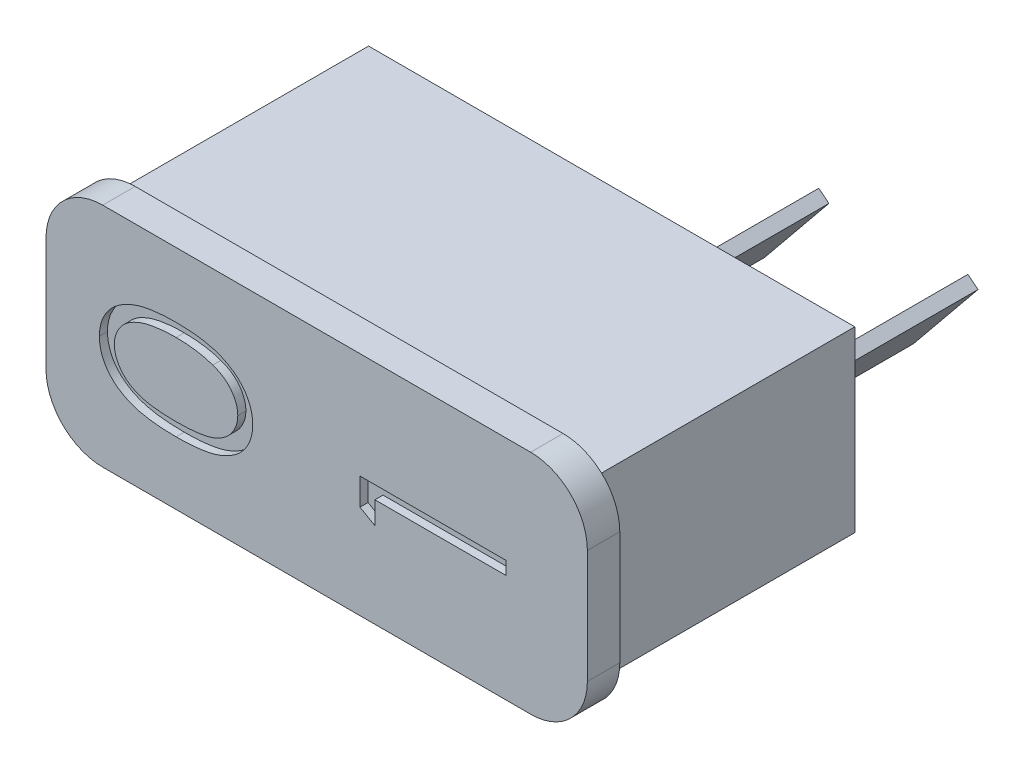
from build123d import *

# Parameters (mm, degrees)
ESQUISSE1_W             = 30
ESQUISSE1_H             = 11
BOSS_EXTRU_1_DEPTH      = 16.2
BOSS_EXTRU_2_DEPTH      = 9.1
ESQUISSE3_W             = 33.4
ESQUISSE3_H             = 14
BOSS_EXTRU_3_DEPTH      = 2
CONG_1_R                = 3.5
ENL_V_MAT_EXTRU_1_DEPTH = 0.5


with BuildPart() as part:
    # Esquisse1 → Boss.-Extru.1 (new body)
    with BuildSketch(Plane.XY):
        Rectangle(ESQUISSE1_W, ESQUISSE1_H)
    extrude(amount=BOSS_EXTRU_1_DEPTH)

    # Esquisse2 → Boss.-Extru.2 (add)
    with BuildSketch(Plane(origin=(0, 0, 0), x_dir=(-1, 0, 0), z_dir=(0, 0, -1))):
        Polygon((-9.520156546, -2.694554874), (-13.5, 2.189177928), (-12.879843454, 2.694554874), (-8.9, -2.189177928), align=None)
        Polygon((-0.320156546, -2.694554874), (-4.3, 2.189177928), (-3.679843454, 2.694554874), (0.3, -2.189177928), align=None)
    extrude(amount=BOSS_EXTRU_2_DEPTH)

    # Esquisse3 → Boss.-Extru.3 (add)
    with BuildSketch(Plane.XY.offset(16.2)):
        Rectangle(ESQUISSE3_W, ESQUISSE3_H)
    extrude(amount=BOSS_EXTRU_3_DEPTH)

    # Congé1
    cong_1_edges = [part.edges().sort_by_distance(p)[0] for p in [
        (16.7, -7, 17.2),
        (16.7, 7, 17.2),
        (-16.7, 7, 17.2),
        (-16.7, -7, 17.2),
    ]]
    fillet(cong_1_edges, radius=CONG_1_R)

    # Esquisse5 → Enlèv. mat.-Extru.1 (cut)
    # profile 1 of 2: a face of its own
    with BuildSketch(Plane.XY.offset(18.2)):
        with BuildLine():
            add(Edge.make_bspline(
                [(-8.672344116, -3.115384615), (-8.816594542, -3.11454114), (-9.096803073, -3.112902677), (-9.505106438, -3.094675309), (-9.888147182, -3.064395858), (-10.245943635, -3.022899755), (-10.578588179, -2.972402097), (-10.885191819, -2.904990826), (-11.167173735, -2.828329399), (-11.425453052, -2.739480033), (-11.663510816, -2.639226475), (-11.885744181, -2.530107135), (-12.0918336, -2.40780713), (-12.285008724, -2.279261226), (-12.462319222, -2.139465144), (-12.62580805, -1.99141638), (-12.774096473, -1.832153938), (-12.907286041, -1.663222517), (-13.024073857, -1.485767046), (-13.127578093, -1.304636715), (-13.212833981, -1.116595132), (-13.282575645, -0.924117757), (-13.339507374, -0.72679892), (-13.378613639, -0.524688996), (-13.403175484, -0.317319479), (-13.405526699, -0.177353753), (-13.406719116, -0.106370192)],
                knots=[0, 0, 0, 0, 1.646148282, 3.197666765, 4.66315463, 6.030252048, 7.307778049, 8.501004361, 9.610818041, 10.641065266, 11.615491391, 12.557119604, 13.464013759, 14.348536654, 15.203310953, 16.038349431, 16.863300206, 17.683791446, 18.490318933, 19.285717724, 20.06220424, 20.843281102, 21.620494212, 22.403315558, 23.190242141, 24, 24, 24, 24], degree=3))
            add(Edge.make_bspline(
                [(-13.406719116, -0.106370192), (-13.405725902, -0.034758535), (-13.403749756, 0.107723458), (-13.375934308, 0.317616697), (-13.340032104, 0.523853953), (-13.28245088, 0.7233062), (-13.213547479, 0.919744698), (-13.122630536, 1.108284414), (-13.0237513, 1.295581798), (-12.90312695, 1.47312818), (-12.769817193, 1.646228322), (-12.618476538, 1.808491632), (-12.453293353, 1.964065993), (-12.270583572, 2.107075425), (-12.073148677, 2.243649111), (-11.859333594, 2.368602577), (-11.629612167, 2.484534626), (-11.385049352, 2.593624475), (-11.119112495, 2.689020666), (-10.833460316, 2.773835506), (-10.525506096, 2.843355619), (-10.196965336, 2.90084753), (-9.846210449, 2.945472196), (-9.473952104, 2.977949275), (-9.079957413, 2.995110587), (-8.810580002, 2.99834183), (-8.672344116, 3)],
                knots=[0, 0, 0, 0, 0.810910589, 1.61342667, 2.396193133, 3.181089899, 3.963115317, 4.752255436, 5.550715454, 6.36105385, 7.181178335, 8.024612154, 8.872680183, 9.750181803, 10.651284446, 11.591556747, 12.554036451, 13.566402641, 14.62422919, 15.753422176, 16.94128843, 18.199818041, 19.531985927, 20.947085226, 22.433341622, 24, 24, 24, 24], degree=3))
            add(Edge.make_bspline(
                [(-8.672344116, 3), (-8.534712415, 2.998305349), (-8.265942373, 2.994995999), (-7.873701987, 2.978317337), (-7.503450196, 2.944678932), (-7.154792256, 2.903215364), (-6.827566515, 2.845080871), (-6.521986194, 2.775033615), (-6.2369694, 2.695225184), (-5.974558239, 2.598364918), (-5.730419815, 2.491814224), (-5.502387515, 2.376006578), (-5.288628898, 2.251758245), (-5.090673237, 2.117232847), (-4.908696823, 1.971871056), (-4.74294709, 1.816405738), (-4.590643844, 1.652725679), (-4.455865409, 1.478616394), (-4.334322685, 1.299416276), (-4.231855178, 1.112099864), (-4.143073095, 0.921461088), (-4.070485552, 0.725596603), (-4.014193065, 0.524808811), (-3.975495046, 0.318430198), (-3.948293311, 0.107693838), (-3.9462218, -0.034768443), (-3.945180655, -0.106370192)],
                knots=[0, 0, 0, 0, 1.561645053, 3.049612875, 4.452756685, 5.778837748, 7.032101753, 8.221335837, 9.334924186, 10.387562255, 11.392109817, 12.355697819, 13.287721948, 14.19548756, 15.068665045, 15.927346723, 16.771751757, 17.602390507, 18.423119567, 19.225778204, 20.022010933, 20.807278863, 21.593079439, 22.384715467, 23.188155646, 24, 24, 24, 24], degree=3))
            add(Edge.make_bspline(
                [(-3.945180655, -0.106370192), (-3.946379855, -0.1773522), (-3.948744442, -0.317314863), (-3.973208323, -0.524706815), (-4.012539618, -0.726004524), (-4.067610881, -0.922201329), (-4.13502048, -1.114303766), (-4.22284416, -1.299694332), (-4.323989205, -1.480433653), (-4.439176304, -1.65604218), (-4.571150652, -1.823209934), (-4.717099564, -1.982916346), (-4.880765666, -2.131001619), (-5.059572209, -2.269585542), (-5.253034743, -2.399490408), (-5.461283099, -2.520733579), (-5.684672864, -2.632141235), (-5.924612019, -2.734107607), (-6.184724486, -2.824512173), (-6.467425199, -2.904059364), (-6.775585556, -2.967591262), (-7.107640965, -3.021444367), (-7.464266137, -3.064597565), (-7.845590095, -3.094662735), (-8.250888737, -3.11288884), (-8.529295376, -3.114537509), (-8.672344116, -3.115384615)],
                knots=[0, 0, 0, 0, 0.810927267, 1.598990287, 2.382942141, 3.152806972, 3.926217614, 4.706701772, 5.493896336, 6.292070767, 7.104102563, 7.925577746, 8.761822141, 9.623241997, 10.509042271, 11.423174113, 12.375371989, 13.360203808, 14.400680605, 15.520553799, 16.714061498, 17.994519714, 19.364400916, 20.818312473, 22.365209998, 24, 24, 24, 24], degree=3))
        make_face()
        with BuildLine():
            add(Edge.make_bspline(
                [(-8.675949886, -2.307692308), (-8.555739426, -2.307378423), (-8.32243453, -2.306769235), (-7.984001554, -2.291315187), (-7.667814755, -2.269804728), (-7.373997537, -2.242743333), (-7.103576783, -2.202215046), (-6.855428255, -2.156233227), (-6.630011273, -2.10108084), (-6.425355958, -2.035503901), (-6.238564308, -1.960805385), (-6.064657667, -1.879390931), (-5.901574914, -1.791153635), (-5.749711712, -1.694284826), (-5.610924423, -1.58686934), (-5.481695105, -1.47388697), (-5.366518241, -1.350247925), (-5.228358565, -1.179245905), (-5.085597394, -0.953479952), (-4.961278178, -0.669028437), (-4.883152037, -0.376737863), (-4.873216642, -0.17834897), (-4.868257578, -0.079326923)],
                knots=[0, 0, 0, 0, 1.459098681, 2.831824031, 4.11146945, 5.306290378, 6.412266529, 7.42953815, 8.369053297, 9.227277979, 10.03601793, 10.809473603, 11.557037441, 12.285528272, 12.993193355, 13.685654407, 14.36688038, 15.041354379, 16.352855396, 17.594313975, 18.799247529, 20, 20, 20, 20], degree=3))
            add(Edge.make_bspline(
                [(-4.868257578, -0.079326923), (-4.872599831, 0.020268324), (-4.881268934, 0.219105532), (-4.956929449, 0.511127608), (-5.079929419, 0.792278573), (-5.220453969, 1.014159934), (-5.355136893, 1.182494904), (-5.469834642, 1.303148633), (-5.598299711, 1.413876824), (-5.736895921, 1.518900078), (-5.88828286, 1.615223199), (-6.051729325, 1.702814186), (-6.227690112, 1.782742777), (-6.350526578, 1.828280326), (-6.413329693, 1.8515625)],
                knots=[0, 0, 0, 0, 1.353621445, 2.702441307, 4.075953605, 5.516772412, 6.261413105, 7.007624062, 7.778524365, 8.566925914, 9.372323995, 10.217594641, 11.088702136, 12, 12, 12, 12], degree=3))
            add(Edge.make_bspline(
                [(-6.413329693, 1.8515625), (-6.493634738, 1.878695617), (-6.656688417, 1.933787481), (-6.909623522, 2.004789187), (-7.175002058, 2.060705927), (-7.451238073, 2.111011725), (-7.740368732, 2.145348154), (-8.041499434, 2.172985389), (-8.354857222, 2.189264298), (-8.567758628, 2.191282229), (-8.675949886, 2.192307692)],
                knots=[0, 0, 0, 0, 0.884706709, 1.796334032, 2.740027952, 3.714592787, 4.726048262, 5.777819803, 6.87074269, 8, 8, 8, 8], degree=3))
            add(Edge.make_bspline(
                [(-8.675949886, 2.192307692), (-8.784123643, 2.19089292), (-8.995734639, 2.188125323), (-9.305638532, 2.177546497), (-9.599984203, 2.150228735), (-9.880039702, 2.119888142), (-10.144254773, 2.075152436), (-10.394841251, 2.026918055), (-10.628694816, 1.962115009), (-10.849476345, 1.892892484), (-11.054678905, 1.813666605), (-11.245254183, 1.726451773), (-11.422139784, 1.633320403), (-11.584789178, 1.53211866), (-11.734145807, 1.424256181), (-11.866772982, 1.305865626), (-11.989122286, 1.184465672), (-12.12628489, 1.011809345), (-12.267242107, 0.787609853), (-12.393430821, 0.506705562), (-12.468112707, 0.21598173), (-12.47846943, 0.019038319), (-12.483642193, -0.079326923)],
                knots=[0, 0, 0, 0, 1.313483664, 2.569454835, 3.763100662, 4.901599063, 5.988328865, 7.015709358, 7.99797933, 8.932480776, 9.824041341, 10.666387587, 11.475829342, 12.24921787, 12.990555181, 13.709176526, 14.405678811, 15.080244297, 16.38186033, 17.610124501, 18.806354173, 20, 20, 20, 20], degree=3))
            add(Edge.make_bspline(
                [(-12.483642193, -0.079326923), (-12.478456561, -0.178883567), (-12.468075849, -0.378178222), (-12.393776202, -0.672006713), (-12.267611311, -0.954808682), (-12.12655646, -1.179747502), (-11.989648182, -1.350306344), (-11.873123474, -1.471338898), (-11.74698074, -1.585888179), (-11.606962249, -1.690522154), (-11.455634138, -1.786816559), (-11.29466033, -1.87846391), (-11.120428745, -1.958789639), (-10.933783565, -2.033727971), (-10.729116994, -2.099414291), (-10.502884375, -2.1539365), (-10.254143251, -2.203572524), (-9.981746648, -2.239318551), (-9.687866721, -2.270795303), (-9.370871329, -2.291079041), (-9.031276204, -2.30684003), (-8.796764226, -2.307402525), (-8.675949886, -2.307692308)],
                knots=[0, 0, 0, 0, 1.207546505, 2.417292871, 3.651582144, 4.952510111, 5.626719005, 6.30238548, 6.989136872, 7.692112372, 8.420316868, 9.164734959, 9.937886623, 10.746308695, 11.604196049, 12.543341915, 13.568754172, 14.680483261, 15.875568977, 17.154711427, 18.534182925, 20, 20, 20, 20], degree=3))
        make_face(mode=Mode.SUBTRACT)
    # profile 2 of 2: a face of its own
    with BuildSketch(Plane.XY.offset(18.2)):
        Polygon((2.670203961, -1.202524038), (2.670203961, 0.461538462), (11.670203961, 0.461538462), (11.670203961, -0.346153846), (3.593280884, -0.346153846), (3.593280884, -1.730769231), align=None)
    extrude(amount=-ENL_V_MAT_EXTRU_1_DEPTH, mode=Mode.SUBTRACT)


solid = part.part
